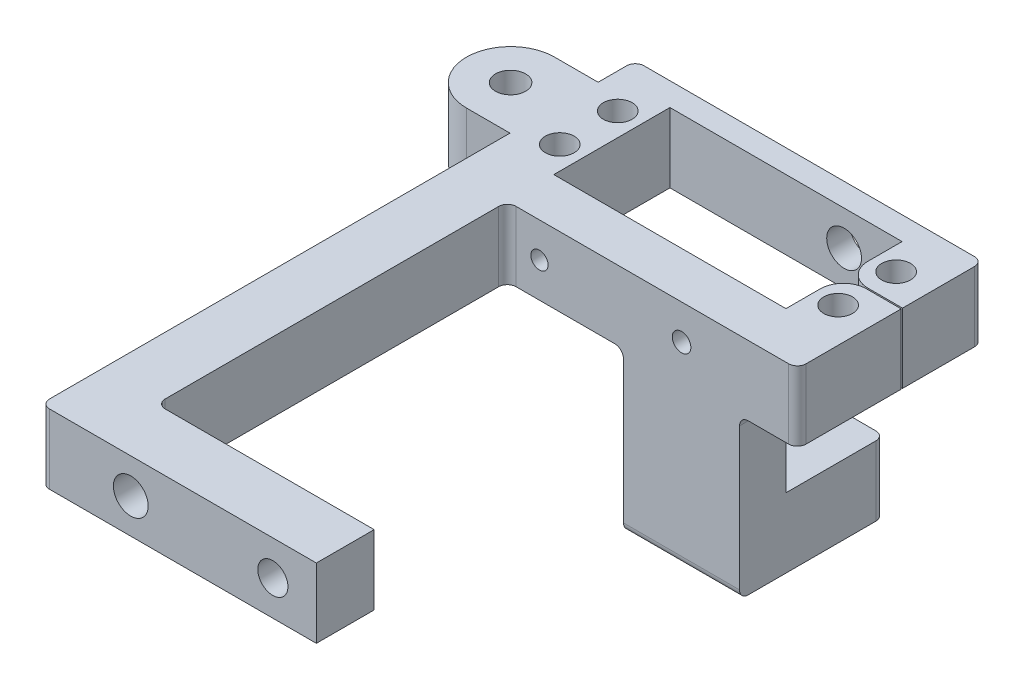
from build123d import *

# Parameters (mm, degrees)
SKETCH1_R               = 2.485
SKETCH1_R_2             = 2.6
BOSS_EXTRUDE1_DEPTH     = 6
SKETCH2_R               = 2.485
BOSS_EXTRUDE2_DEPTH     = 2
SKETCH3_R               = 1.6
CUT_EXTRUDE1_DEPTH      = 10
SKETCH4_R               = 3
CUT_EXTRUDE2_DEPTH      = 28.03
BOSS_EXTRUDE3_DEPTH     = 20.015
SKETCH6_R               = 2.485
CUT_EXTRUDE3_DEPTH      = 10
CUT_EXTRUDE6_DEPTH      = 91.116192357
CUT_EXTRUDE6_DEPTH_BACK = 6
SKETCH10_R              = 1.485
SKETCH9_R               = 3
SKETCH9_R_2             = 1.485
SKETCH9_R_3             = 2.6
SKETCH9_R_4             = 1.6
CUT_EXTRUDE5_DEPTH      = 109.243744046
FILLET1_R               = 1.5


with BuildPart() as part:
    # Sketch1 → Boss-Extrude1 (new, symmetric)
    with BuildSketch(Plane(origin=(0, 0, 0), x_dir=(1, 0, 0), z_dir=(0, 1, 0))):
        with BuildLine():
            Line((20.015, -4.1), (20.015, -10.015))
            Line((20.015, -10.015), (-20.015, -10.015))
            Line((-20.015, -10.015), (-20.015, 10.015))
            Line((-20.015, 10.015), (20.015, 10.015))
            Line((20.015, 10.015), (20.015, 4.1))
            ThreePointArc((20.015, 4.1), (21.182179477, 1.282179477), (24, 0.115))
            Line((24, 0.115), (29.985, 0.115))
            Line((29.985, 0.115), (29.985, 14.015))
            Line((29.985, 14.015), (-29.985, 14.015))
            Line((-29.985, 14.015), (-29.985, 7.6))
            Line((-29.985, 7.6), (-37.485, 7.6))
            ThreePointArc((-37.485, 7.6), (-45.085, 0), (-37.485, -7.6))
            Line((-37.485, -7.6), (-29.985, -7.6))
            Line((-29.985, -7.6), (-29.985, -88.485))
            Line((-29.985, -88.485), (17.515, -88.485))
            Line((17.515, -88.485), (17.515, -78.515))
            Line((17.515, -78.515), (-20.015, -78.515))
            Line((-20.015, -78.515), (-20.015, -18.015))
            Line((-20.015, -18.015), (29.985, -18.015))
            Line((29.985, -18.015), (29.985, -0.115))
            Line((29.985, -0.115), (24, -0.115))
            ThreePointArc((24, -0.115), (21.182179477, -1.282179477), (20.015, -4.1))
        make_face()
        with Locations(Location((-24, -5, 0), (0, 0, 270))):
            Circle(SKETCH1_R, mode=Mode.SUBTRACT)
        with Locations(Location((-24, 5, 0), (0, 0, 270))):
            Circle(SKETCH1_R, mode=Mode.SUBTRACT)
        with Locations(Location((24, -5, 0), (0, 0, 270))):
            Circle(SKETCH1_R, mode=Mode.SUBTRACT)
        with Locations(Location((24, 5, 0), (0, 0, 270))):
            Circle(SKETCH1_R, mode=Mode.SUBTRACT)
        with Locations(Location((-37.485, 0, 0), (0, 0, 270))):
            Circle(SKETCH1_R_2, mode=Mode.SUBTRACT)
    extrude(amount=BOSS_EXTRUDE1_DEPTH, both=True)

    # Sketch2 → Boss-Extrude2 (add)
    with BuildSketch(Plane.XZ.offset(6)):
        with Locations(Location((24, -5, 0), (0, 0, 90))):
            Circle(SKETCH2_R)
        with Locations(Location((24, 5, 0), (0, 0, 90))):
            Circle(SKETCH2_R)
        with Locations(Location((-24, -5, 0), (0, 0, 90))):
            Circle(SKETCH2_R)
        with Locations(Location((-24, 5, 0), (0, 0, 90))):
            Circle(SKETCH2_R)
    extrude(amount=-BOSS_EXTRUDE2_DEPTH)

    # Sketch3 → Cut-Extrude1 (cut)
    with BuildSketch(Plane.XY.offset(18.015)):
        with Locations((10.015, 0)):
            Circle(SKETCH3_R)
    extrude(amount=-CUT_EXTRUDE1_DEPTH, mode=Mode.SUBTRACT)

    # Sketch4 → Cut-Extrude2 (cut)
    with BuildSketch(Plane(origin=(0, 0, -14.015), x_dir=(-1, 0, 0), z_dir=(0, 0, -1))):
        with Locations(Location((-10.015, 0, 0), (0, 0, 180))):
            Circle(SKETCH4_R)
    extrude(amount=-CUT_EXTRUDE2_DEPTH, mode=Mode.SUBTRACT)

    # Sketch5 → Boss-Extrude3 (add)
    with BuildSketch(Plane(origin=(0, 0, 0), x_dir=(0, 0, -1), z_dir=(1, 0, 0))):
        Polygon((-18.015, -6), (-10.015, -6), (-10.015, -21.5), (6.985, -21.5), (6.985, -33.5), (-18.015, -33.5), align=None)
    extrude(amount=BOSS_EXTRUDE3_DEPTH)

    # Sketch6 → Cut-Extrude3 (cut)
    with BuildSketch(Plane.XZ.offset(33.5)):
        with Locations(Location((10.015, 0, 0), (0, 0, 270))):
            Circle(SKETCH6_R)
    extrude(amount=-CUT_EXTRUDE3_DEPTH, mode=Mode.SUBTRACT)

    # Sketch10 → Cut-Extrude6 (cut, two sides: drawn at the far end of the back side and taken through both)
    with BuildSketch(Plane.XY.offset(18.015).offset(-CUT_EXTRUDE6_DEPTH_BACK)):
        with Locations((-14.485, 0)):
            Circle(SKETCH10_R)
    extrude(amount=CUT_EXTRUDE6_DEPTH + CUT_EXTRUDE6_DEPTH_BACK, mode=Mode.SUBTRACT)

    # Sketch9 → Cut-Extrude5 (cut, through all)
    # profile 1 of 3: a face of its own
    with BuildSketch(Plane(origin=(0, 0, 78.515), x_dir=(-1, 0, 0), z_dir=(0, 0, -1))):
        with Locations((14.485, 0)):
            Circle(SKETCH9_R)
        with Locations(Location((14.485, 0, 0), (0, 0, 180))):
            Circle(SKETCH9_R_2, mode=Mode.SUBTRACT)
    # profile 2 of 3: a face of its own
    with BuildSketch(Plane(origin=(0, 0, 78.515), x_dir=(-1, 0, 0), z_dir=(0, 0, -1))):
        with Locations((-10.015, 0)):
            Circle(SKETCH9_R_3)
        with Locations(Location((-10.015, 0, 0), (0, 0, 180))):
            Circle(SKETCH9_R_4, mode=Mode.SUBTRACT)
    # profile 3 of 3: a face of its own
    with BuildSketch(Plane(origin=(0, 0, 78.515), x_dir=(-1, 0, 0), z_dir=(0, 0, -1))):
        with Locations(Location((-10.015, 0, 0), (0, 0, 180))):
            Circle(SKETCH9_R_4)
    extrude(amount=-CUT_EXTRUDE5_DEPTH, mode=Mode.SUBTRACT)

    # Fillet1
    fillet1_edges = [part.edges().sort_by_distance(p)[0] for p in [
        (20.015, -6, 14.015),
        (0, -6, 14.015),
        (20.015, -27.5, -6.985),
        (0, -27.5, -6.985),
        (10.0075, -33.5, 18.015),
        (-29.985, 0, -14.015),
        (29.985, 0, -14.015),
        (29.985, 0, 18.015),
        (-20.015, 0, 18.015),
        (-20.015, 0, 78.515),
        (-29.985, 0, 88.485),
    ]]
    fillet(fillet1_edges, radius=FILLET1_R)


solid = part.part
